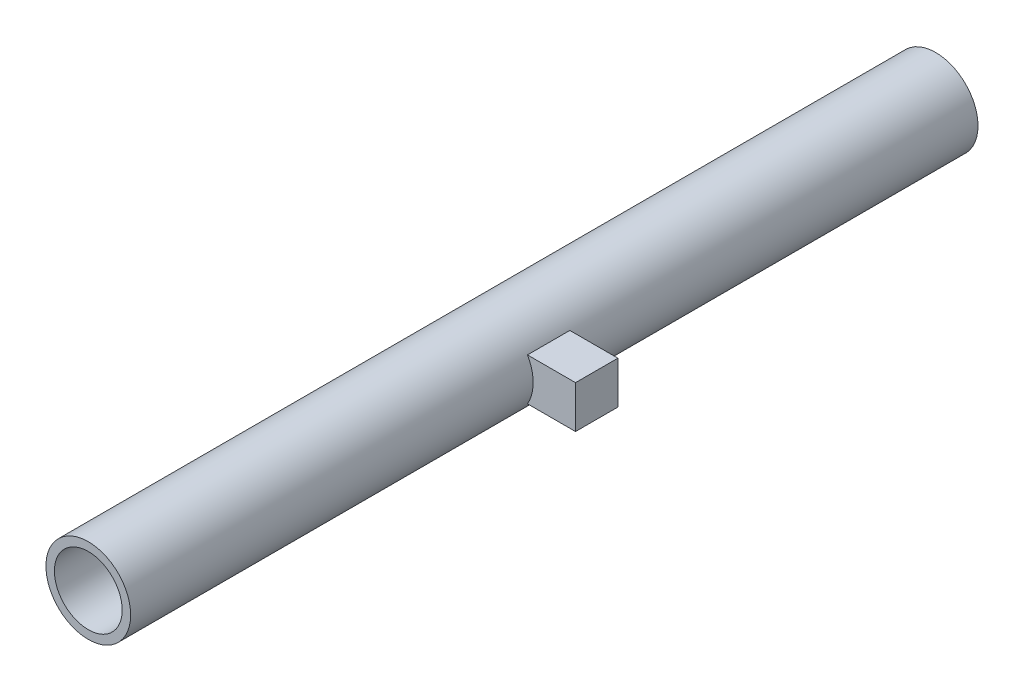
from build123d import *

# Parameters (mm, degrees)
SKIZZE1_R                       = 5
SKIZZE1_R_2                     = 4
AUFSATZ_LINEAR_AUSTRAGEN1_DEPTH = 100
BOSS_EXTRUDE2_REACH             = 103.242
BOSS_EXTRUDE2_END_RADIUS        = 5
SKETCH1_W                       = 5
SKETCH1_H                       = 5


with BuildPart() as part:
    # Skizze1 → Aufsatz-Linear austragen1 (new body)
    with BuildSketch(Plane.XY):
        Circle(SKIZZE1_R)
        Circle(SKIZZE1_R_2, mode=Mode.SUBTRACT)
    extrude(amount=AUFSATZ_LINEAR_AUSTRAGEN1_DEPTH)

    # Boss-Extrude2: up to this cylinder (the profile starts outside it)
    boss_extrude2_end = Plane(origin=(0, 0, 50), z_dir=(0, 0, -1)) * Cylinder(BOSS_EXTRUDE2_END_RADIUS, 217.484, mode=Mode.PRIVATE)
    # Sketch1 → Boss-Extrude2 (add, up to the surface)
    with BuildSketch(Plane(origin=(10, 0, 0), x_dir=(0, 0, -1), z_dir=(1, 0, 0)), mode=Mode.PRIVATE) as boss_extrude2_sk1:
        with Locations((-50, 0)):
            Rectangle(SKETCH1_W, SKETCH1_H)
    boss_extrude2_tool1 = extrude(boss_extrude2_sk1.sketch, amount=-BOSS_EXTRUDE2_REACH, mode=Mode.PRIVATE) - boss_extrude2_end
    add(boss_extrude2_tool1.solids().sort_by_distance((10, 0, 50))[0])


solid = part.part
